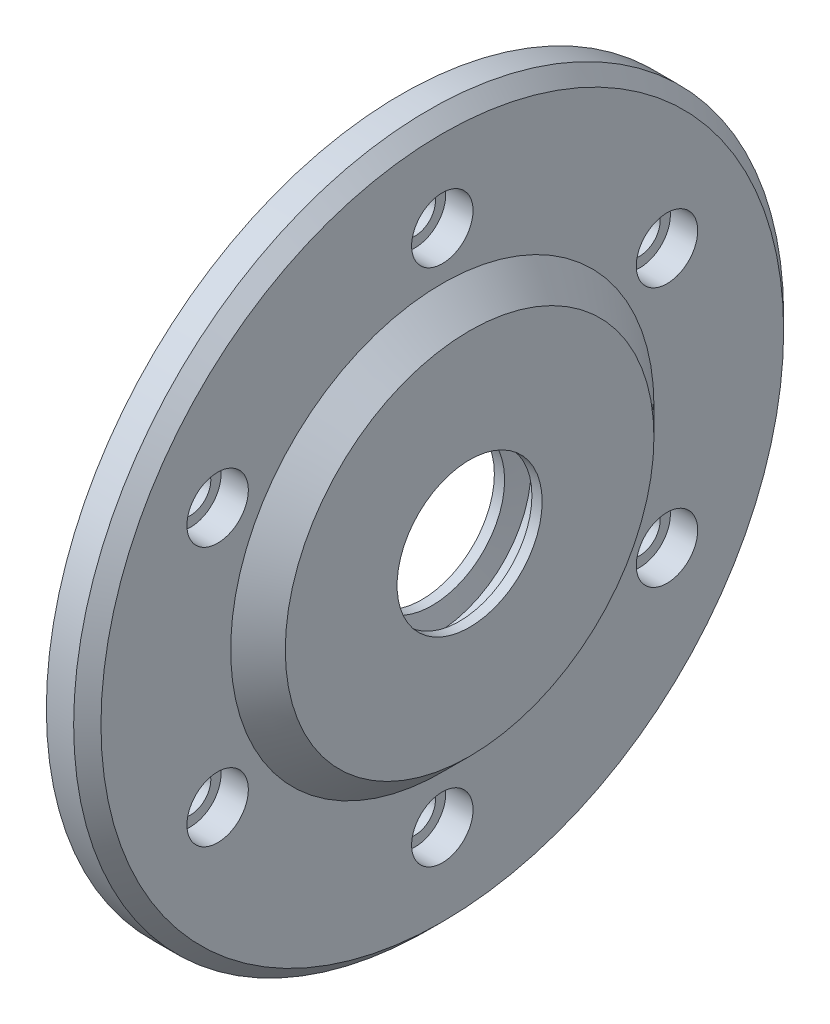
from build123d import *

# Parameters (mm, degrees)
SKETCH_1_W                = 6
SKETCH_1_H                = 52
SKETCH_2_R                = 31
EXTRUDE_1_DEPTH           = 4
EXTRUDE_1_TAPER           = 45
SKETCH_3_R                = 33
EXTRUDE_2_DEPTH           = 1
HOLE_WIZARD_1_D           = 6
HOLE_WIZARD_1_DEPTH       = 7
HOLE_WIZARD_1_CBORE_D     = 9
HOLE_WIZARD_1_CBORE_DEPTH = 4
CHAMFER_1_SIZE            = 2


with BuildPart() as part:
    # Эскиз1 → Повернуть1 (revolve)
    with BuildSketch(Plane.XY, mode=Mode.PRIVATE) as revolve_1_sk:
        with Locations((3, 26)):
            Rectangle(SKETCH_1_W, SKETCH_1_H)
    revolve(revolve_1_sk.sketch.rotate(Axis((0, 0, 0), (1, 0, 0)), 270), axis=Axis((0, 0, 0), (1, 0, 0)))

    # Эскиз2 → Бобышка-Вытянуть1 (add)
    with BuildSketch(Plane(origin=(6, 0, 0), x_dir=(0, 0, -1), z_dir=(1, 0, 0))):
        Circle(SKETCH_2_R)
    extrude(amount=EXTRUDE_1_DEPTH, taper=EXTRUDE_1_TAPER)

    # Эскиз3 → Бобышка-Вытянуть2 (add)
    with BuildSketch(Plane.ZY):
        Circle(SKETCH_3_R)
    extrude(amount=EXTRUDE_2_DEPTH)

    # Эскиз4 → Вырез-Повернуть1 (revolve, cut)
    with BuildSketch(Plane.XY, mode=Mode.PRIVATE) as cut_revolve_1_sk:
        Polygon((-1, 25), (-1, 0), (10, 0), (10, 10.626409128), (8.5, 10.626409128), (8, 14), (5, 14), (4.5, 10.626409128), (3, 10.626409128), (3, 18), (0, 18), (0, 25), align=None)
    revolve(cut_revolve_1_sk.sketch.rotate(Axis((-1, 0, 0), (1, 0, 0)), 270), axis=Axis((-1, 0, 0), (1, 0, 0)), mode=Mode.SUBTRACT)

    # Отверстие1
    with Locations(Plane(origin=(6, 0, 0), x_dir=(0, 0, -1), z_dir=(1, 0, 0))):
        with Locations((32.908965344, -19), (0, -38), (-32.908965344, -19), (-32.908965344, 19), (0, 38), (32.908965344, 19)):
            CounterBoreHole(HOLE_WIZARD_1_D / 2, HOLE_WIZARD_1_CBORE_D / 2, HOLE_WIZARD_1_CBORE_DEPTH, depth=HOLE_WIZARD_1_DEPTH)

    # Фаска1
    chamfer_1_edges = [part.edges().sort_by_distance(p)[0] for p in [
        (6, 0, 52),
    ]]
    chamfer(chamfer_1_edges, length=CHAMFER_1_SIZE)


solid = part.part
